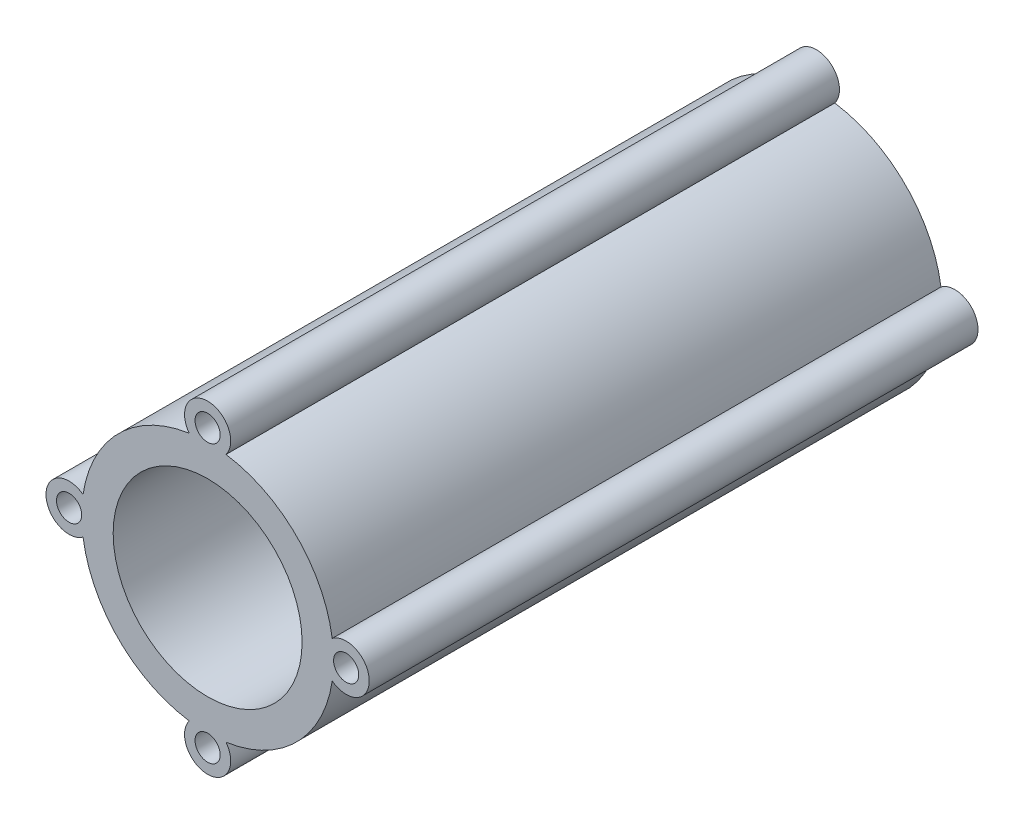
from build123d import *

# Parameters (mm, degrees)
SKETCH1_R               = 30
SKETCH1_R_2             = 22.5
BOSS_EXTRUDE2_DEPTH     = 145
CROQUIS1_R              = 5.5
CROQUIS1_R_2            = 3
SALIENTE_EXTRUIR1_DEPTH = 145
MATRIZC1_COUNT          = 4


with BuildPart() as part:
    # Sketch1 → Boss-Extrude2 (new body)
    with BuildSketch(Plane.XY):
        Circle(SKETCH1_R)
        Circle(SKETCH1_R_2, mode=Mode.SUBTRACT)
    extrude(amount=BOSS_EXTRUDE2_DEPTH)

    # Croquis1 → Saliente-Extruir1 (add)
    with BuildSketch(Plane.XY):
        with Locations((-33, 0)):
            Circle(CROQUIS1_R)
        with Locations((-33, 0)):
            Circle(CROQUIS1_R_2, mode=Mode.SUBTRACT)
    saliente_extruir1 = extrude(amount=SALIENTE_EXTRUIR1_DEPTH)

    # MatrizC1: Saliente-Extruir1 ×4 about axis
    matrizc1_axis = Axis((0, 0, 0), (0, 0, 1))
    for i in range(1, MATRIZC1_COUNT):
        add(saliente_extruir1.rotate(matrizc1_axis, i * 360 / MATRIZC1_COUNT))


solid = part.part
